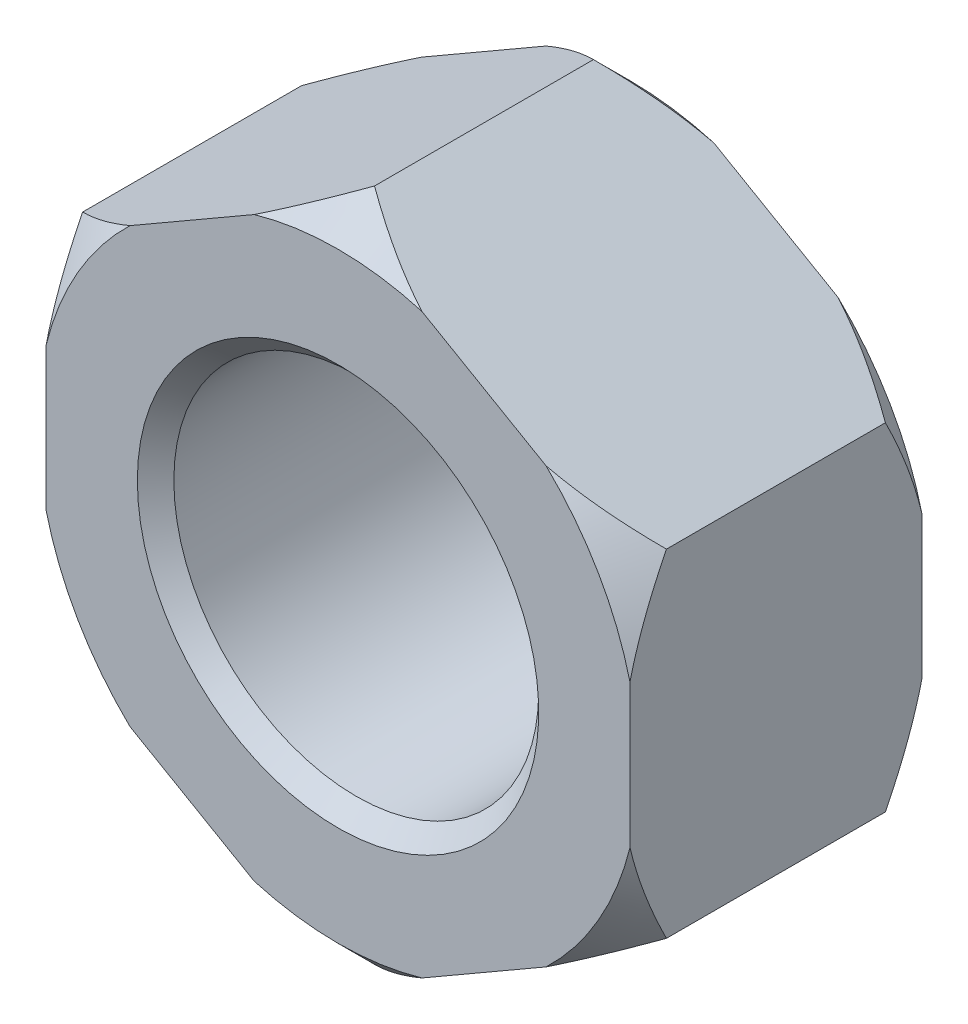
from build123d import *

# Parameters (mm, degrees)
EXTRUDE_1_DEPTH     = 4
SKETCH_2_R          = 2.5
CUT_EXTRUDE_1_DEPTH = 8.302967433
CHAMFER_1_SIZE      = 0.25


with BuildPart() as part:
    # Эскиз1 → Вытянуть1 (new body)
    with BuildSketch(Plane.XY):
        Polygon((0, 4.618802154), (-4, 2.309401077), (-4, -2.309401077), (0, -4.618802154), (4, -2.309401077), (4, 2.309401077), align=None)
    extrude(amount=EXTRUDE_1_DEPTH)

    # Эскиз15 → Вырез-Повернуть1 (revolve, cut)
    with BuildSketch(Plane(origin=(0, 0, 0), x_dir=(0, 0, -1), z_dir=(1, 0, 0))):
        Polygon((-4, 4.618802154), (-4, 4.118802154), (-3.5, 4.618802154), align=None)
        Polygon((-0.5, 4.618802154), (0, 4.618802154), (0, 4.118802154), align=None)
    revolve(axis=Axis((0, 0, 2.633835381), (0, 0, -1)), mode=Mode.SUBTRACT)

    # Эскиз2 → Вырез-Вытянуть1 (cut, through all)
    with BuildSketch(Plane(origin=(0, 0, 0), x_dir=(-1, 0, 0), z_dir=(0, 0, -1))):
        Circle(SKETCH_2_R)
    extrude(amount=-CUT_EXTRUDE_1_DEPTH, mode=Mode.SUBTRACT)

    # Фаска1
    chamfer_1_edges = [part.edges().sort_by_distance(p)[0] for p in [
        (2.5, 0, 4),
        (2.5, 0, 0),
    ]]
    chamfer(chamfer_1_edges, length=CHAMFER_1_SIZE)


solid = part.part
